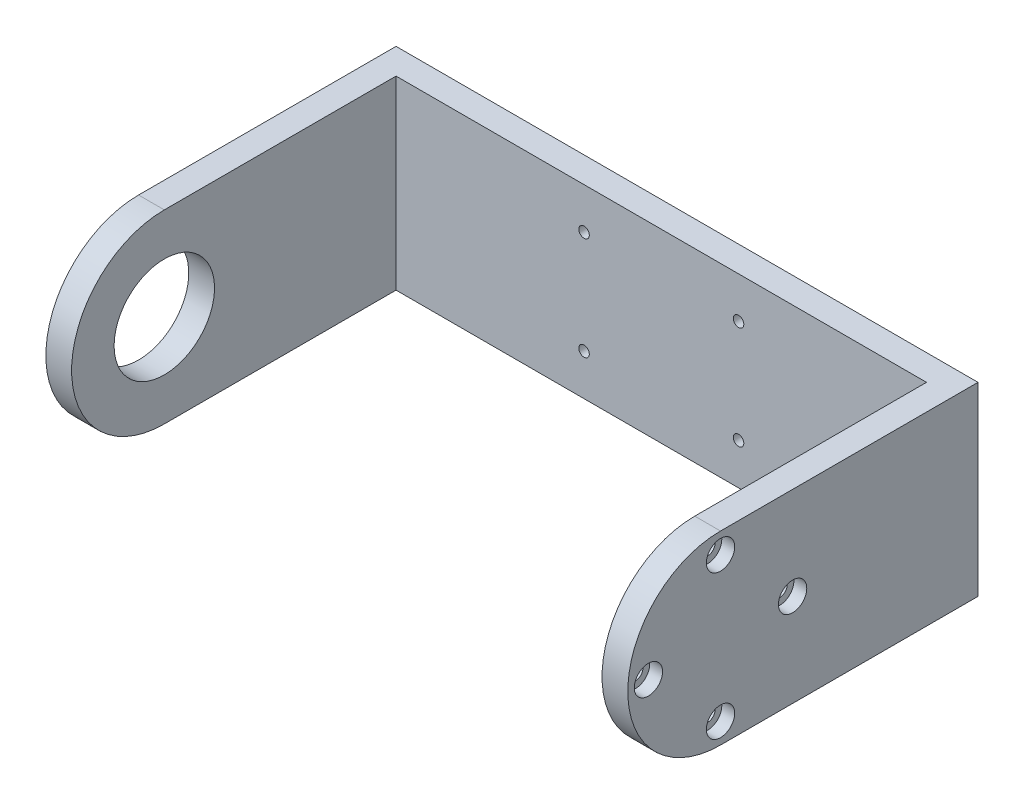
from build123d import *

# Parameters (mm, degrees)
BOSS_EXTRUDE1_DEPTH                               = 5
CBORE_FOR_M2_5_SOCKET_HEAD_CAP_SCREW1_D           = 2.9
CBORE_FOR_M2_5_SOCKET_HEAD_CAP_SCREW1_CBORE_D     = 5.5
CBORE_FOR_M2_5_SOCKET_HEAD_CAP_SCREW1_CBORE_DEPTH = 2.5
SKETCH6_W                                         = 113
SKETCH6_H                                         = 36
BOSS_EXTRUDE2_DEPTH                               = 5
BOSS_EXTRUDE3_DEPTH                               = 5
SKETCH8_R                                         = 9.75
CUT_EXTRUDE1_DEPTH                                = 5
M2_5_TAPPED_HOLE1_D                               = 2.05


with BuildPart() as part:
    # Sketch1 → Boss-Extrude1 (new body)
    with BuildSketch(Plane(origin=(0, 0, 0), x_dir=(0, 0, -1), z_dir=(1, 0, 0))):
        with BuildLine():
            Line((0, 18), (45, 18))
            Line((45, 18), (45, -18))
            Line((45, -18), (0, -18))
            ThreePointArc((0, -18), (-18, 0), (0, 18))
        make_face()
    extrude(amount=BOSS_EXTRUDE1_DEPTH)

    # CBORE for M2.5 Socket Head Cap Screw1 (through all)
    with Locations(Plane(origin=(5, 14, 0), x_dir=(0, 0, 1), z_dir=(1, 0, 0))):
        with Locations((0, 0), (-14, 14), (0, 28), (14, 14)):
            CounterBoreHole(CBORE_FOR_M2_5_SOCKET_HEAD_CAP_SCREW1_D / 2, CBORE_FOR_M2_5_SOCKET_HEAD_CAP_SCREW1_CBORE_D / 2, CBORE_FOR_M2_5_SOCKET_HEAD_CAP_SCREW1_CBORE_DEPTH)

    # Sketch6 → Boss-Extrude2 (add)
    with BuildSketch(Plane(origin=(0, 0, -45), x_dir=(-1, 0, 0), z_dir=(0, 0, -1))):
        with Locations((51.5, 0)):
            Rectangle(SKETCH6_W, SKETCH6_H)
    extrude(amount=BOSS_EXTRUDE2_DEPTH)

    # Sketch7 → Boss-Extrude3 (add)
    with BuildSketch(Plane.ZY.offset(108)):
        with BuildLine():
            Line((-50, -18), (0, -18))
            ThreePointArc((0, -18), (18, 0), (0, 18))
            Line((0, 18), (-50, 18))
            Line((-50, 18), (-50, -18))
        make_face()
    extrude(amount=-BOSS_EXTRUDE3_DEPTH)

    # Sketch8 → Cut-Extrude1 (cut)
    with BuildSketch(Plane.ZY.offset(108)):
        Circle(SKETCH8_R)
    extrude(amount=-CUT_EXTRUDE1_DEPTH, mode=Mode.SUBTRACT)

    # M2.5 Tapped Hole1 (through all)
    with Locations(Plane(origin=(0, 0, -50), x_dir=(-1, 0, 0), z_dir=(0, 0, -1))):
        with Locations((36.5, 10), (66.5, 10), (66.5, -10), (36.5, -10)):
            Hole(M2_5_TAPPED_HOLE1_D / 2)


solid = part.part
